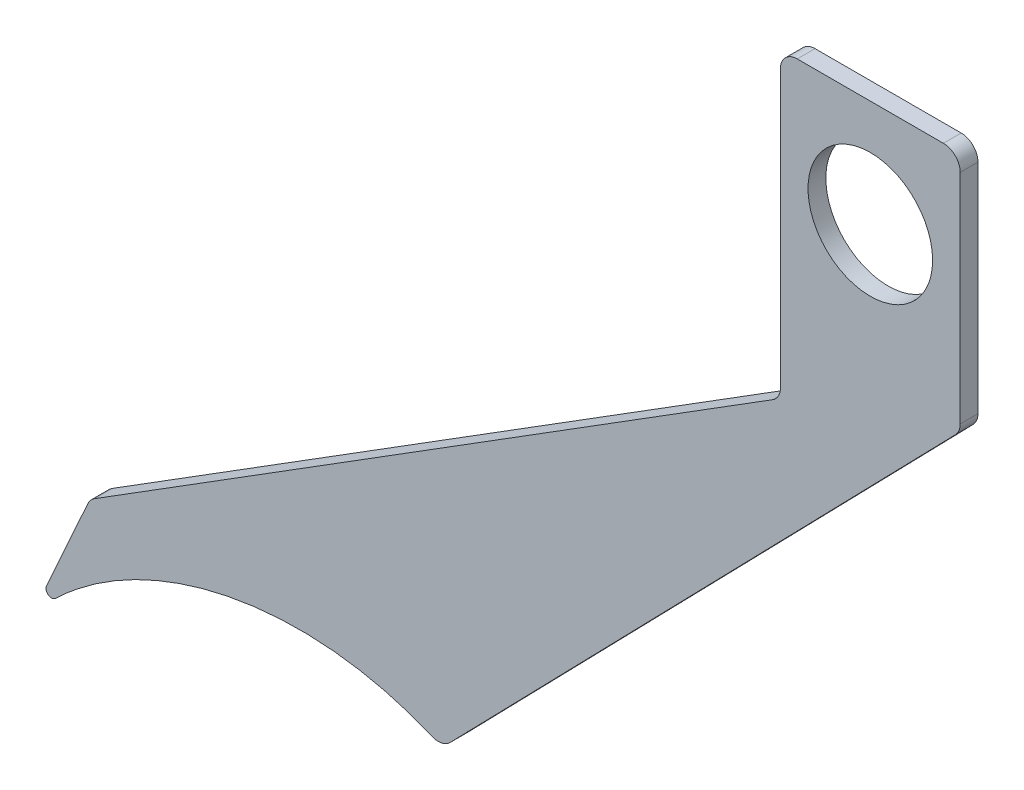
from build123d import *

# Parameters (mm, degrees)
SKETCH2_R           = 11.1125
BOSS_EXTRUDE1_DEPTH = 3.175
FILLET1_R           = 3
FILLET2_R           = 1


with BuildPart() as part:
    # Sketch2 → Boss-Extrude1 (new body)
    with BuildSketch(Plane.XY):
        with BuildLine():
            Line((-364.964629933, 19.05), (-397.035370067, 19.05))
            Line((-397.035370067, 19.05), (-397.035370067, -34.925))
            Line((-397.035370067, -34.925), (-520.207659615, -112.081032385))
            Line((-520.207659615, -112.081032385), (-530.464644327, -134.880029394))
            add(Edge.make_bspline(
                [(-457.420545856, -119.022880851), (-481.278146928, -107.716723517), (-513.288827873, -114.168548124), (-530.464644327, -134.880029394)],
                knots=[0.042886926, 0.042886926, 0.042886926, 0.042886926, 1, 1, 1, 1], degree=3))
            Line((-457.420545856, -119.022880851), (-364.964629933, -24.022670771))
            Line((-364.964629933, -24.022670771), (-364.964629933, 19.05))
        make_face()
        with Locations((-381, 0)):
            Circle(SKETCH2_R, mode=Mode.SUBTRACT)
    extrude(amount=BOSS_EXTRUDE1_DEPTH)

    # Fillet1
    fillet1_edges = [part.edges().sort_by_distance(p)[0] for p in [
        (-520.207659615, -112.081032385, 1.5875),
        (-397.035370067, -34.925, 1.5875),
        (-457.420545856, -119.022880851, 1.5875),
        (-364.964629933, -24.022670771, 1.5875),
        (-397.035370067, 19.05, 1.5875),
        (-364.964629933, 19.05, 1.5875),
    ]]
    fillet(fillet1_edges, radius=FILLET1_R)

    # Fillet2
    fillet2_edges = [part.edges().sort_by_distance(p)[0] for p in [
        (-530.464644327, -134.880029394, 1.5875),
    ]]
    fillet(fillet2_edges, radius=FILLET2_R)


solid = part.part
